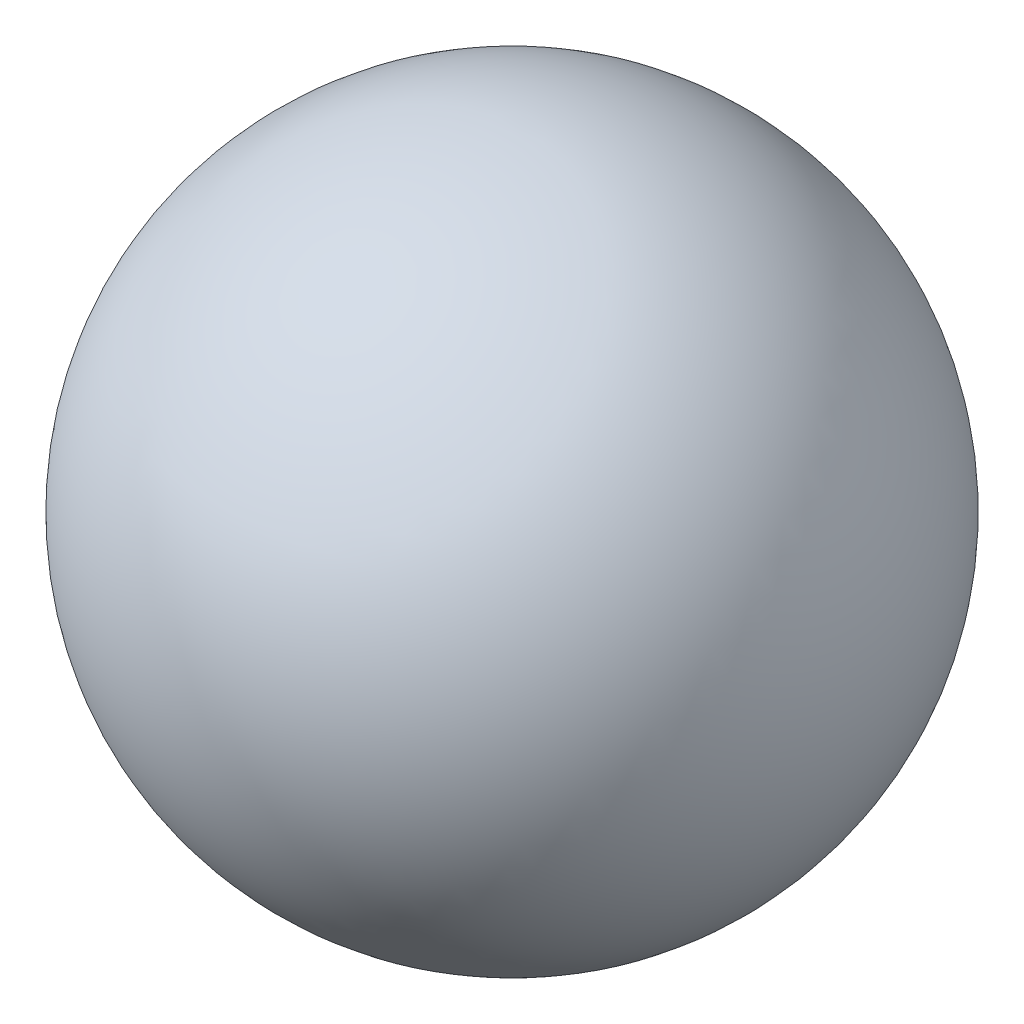
from build123d import *


with BuildPart() as part:
    # Sketch1 → Revolve1 (revolve)
    with BuildSketch(Plane.XY):
        with BuildLine():
            Line((0, 155.575), (0, -155.575))
            ThreePointArc((0, -155.575), (155.575, 0), (0, 155.575))
        make_face()
    revolve(axis=Axis((0, 155.575, 0), (0, -1, 0)))


solid = part.part
